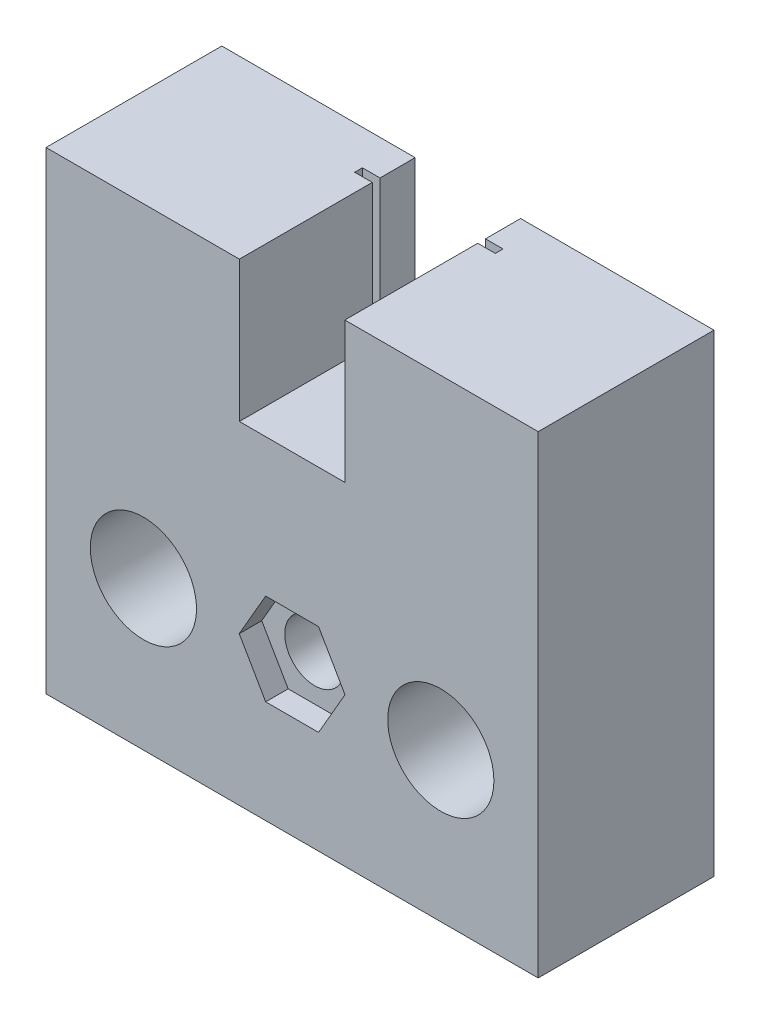
from build123d import *

# Parameters (mm, degrees)
BOSS_EXTRUDE1_DEPTH     = 25
CUT_EXTRUDE1_DEPTH      = 3.2
CUT_EXTRUDE2_DEPTH      = 3.2
CUT_EXTRUDE3_DEPTH      = 62.39542258
CUT_EXTRUDE3_DEPTH_BACK = 62.39542258
SKETCH4_R               = 4.25
CUT_EXTRUDE4_DEPTH      = 63.603178144
CUT_EXTRUDE4_DEPTH_BACK = 63.603178144
SKETCH5_R               = 7.55
CUT_EXTRUDE5_DEPTH      = 20


with BuildPart() as part:
    # Sketch1 → Boss-Extrude1 (new body)
    with BuildSketch(Plane.XY):
        Polygon((-3.843317972, 42.253456221), (31.156682028, 42.253456221), (31.156682028, -25.046543779), (-4.705317324, -25.046543779), (-38.843317972, -25.046543779), (-38.843317972, 42.253456221), align=None)
    extrude(amount=BOSS_EXTRUDE1_DEPTH)

    # Sketch2 → Cut-Extrude1 (cut)
    with BuildSketch(Plane.XY.offset(25)):
        Polygon((3.679556035, -3.896543779), (-0.081880969, 2.618456221), (-7.604754976, 2.618456221), (-11.36619198, -3.896543779), (-7.604754976, -10.411543779), (-0.081880969, -10.411543779), align=None)
    extrude(amount=-CUT_EXTRUDE1_DEPTH, mode=Mode.SUBTRACT)

    # Sketch3 → Cut-Extrude2 (cut)
    with BuildSketch(Plane(origin=(0, 0, 0), x_dir=(-1, 0, 0), z_dir=(0, 0, -1))):
        Polygon((11.36619198, -3.896543779), (7.604754976, 2.618456221), (0.081880969, 2.618456221), (-3.679556035, -3.896543779), (0.081880969, -10.411543779), (7.604754976, -10.411543779), align=None)
    extrude(amount=-CUT_EXTRUDE2_DEPTH, mode=Mode.SUBTRACT)

    # Sketch4 → Cut-Extrude3 (cut, two sides: drawn at the far end of the back side and taken through both)
    with BuildSketch(Plane.XY.offset(21.8).offset(-CUT_EXTRUDE3_DEPTH_BACK)):
        with Locations((-3.843317972, -3.896543779)):
            Circle(SKETCH4_R)
    extrude(amount=CUT_EXTRUDE3_DEPTH + CUT_EXTRUDE3_DEPTH_BACK, mode=Mode.SUBTRACT)

    # Sketch5 → Cut-Extrude4 (cut, two sides: drawn at the far end of the back side and taken through both)
    with BuildSketch(Plane.XY.offset(25).offset(-CUT_EXTRUDE4_DEPTH_BACK)):
        with Locations((17.306682028, -3.896543779)):
            Circle(SKETCH5_R)
        with Locations(Location((-24.993317972, -3.896543779, 0), (0, 0, 180))):
            Circle(SKETCH5_R)
    extrude(amount=CUT_EXTRUDE4_DEPTH + CUT_EXTRUDE4_DEPTH_BACK, mode=Mode.SUBTRACT)

    # Sketch6 → Cut-Extrude5 (cut)
    with BuildSketch(Plane(origin=(0, 42.253456221, 0), x_dir=(1, 0, 0), z_dir=(0, 1, 0))):
        Polygon((-3.843317972, 0), (3.656682028, 0), (3.656682028, -5), (6.156682028, -5), (6.156682028, -6.1), (3.656682028, -6.1), (3.656682028, -25), (-11.343317972, -25), (-11.343317972, -6.1), (-13.843317972, -6.1), (-13.843317972, -5), (-11.343317972, -5), (-11.343317972, 0), align=None)
    extrude(amount=-CUT_EXTRUDE5_DEPTH, mode=Mode.SUBTRACT)


solid = part.part
